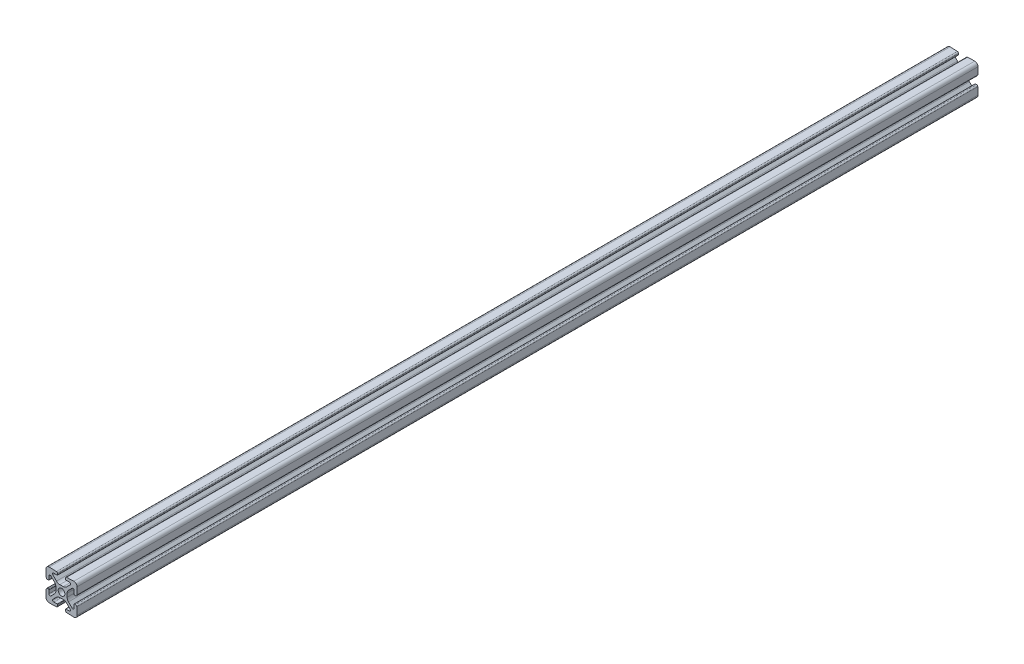
from build123d import *

# Parameters (mm, degrees)
BOSS_EXTRUDE1_DEPTH     = 304.8
CIRPATTERN1_COUNT       = 4
CUT_EXTRUDE1_DEPTH      = 306.611552742
CUT_EXTRUDE1_DEPTH_BACK = 306.611552742
SKETCH4_W               = 20.616616654
SKETCH4_H               = 34.076220988


with BuildPart() as part:
    # Sketch3 → Boss-Extrude1 (new, symmetric)
    with BuildSketch(Plane.XY):
        with BuildLine():
            Line((-2.524916986, 8.30911066), (-2.500487338, 9.008684239))
            ThreePointArc((-2.500487338, 9.008684239), (-2.714917039, 9.582202525), (-3.272080403, 9.836116498))
            Line((-3.272080403, 9.836116498), (-7.930201007, 9.998781654))
            ThreePointArc((-7.930201007, 9.998781654), (-9.414213562, 9.414213562), (-9.998781654, 7.930201007))
            Line((-9.998781654, 7.930201007), (-9.836116498, 3.272080403))
            ThreePointArc((-9.836116498, 3.272080403), (-9.582202525, 2.714917039), (-9.008684239, 2.500487338))
            Line((-9.008684239, 2.500487338), (-8.30911066, 2.524916986))
            ThreePointArc((-8.30911066, 2.524916986), (-8.100174399, 2.620134726), (-8.019763261, 2.835204083))
            Line((-8.019763261, 2.835204083), (-8.093719461, 4.953032548))
            ThreePointArc((-8.093719461, 4.953032548), (-7.631170264, 5.686128657), (-6.779559917, 5.52444538))
            Line((-6.779559917, 5.52444538), (-4.478679656, 3.22356512))
            ThreePointArc((-4.478679656, 3.22356512), (-3.828361402, 2.250295073), (-3.6, 1.102244776))
            Line((-3.6, 1.102244776), (-3.6, 0))
            Line((-3.6, 0), (-2.15, 0))
            ThreePointArc((-2.15, 0), (-1.52027958, 1.52027958), (0, 2.15))
            Line((0, 2.15), (0, 3.6))
            Line((0, 3.6), (-1.102244776, 3.6))
            ThreePointArc((-1.102244776, 3.6), (-2.250295073, 3.828361402), (-3.22356512, 4.478679656))
            Line((-3.22356512, 4.478679656), (-5.52444538, 6.779559917))
            ThreePointArc((-5.52444538, 6.779559917), (-5.686128657, 7.631170264), (-4.953032548, 8.093719461))
            Line((-4.953032548, 8.093719461), (-2.835204083, 8.019763261))
            ThreePointArc((-2.835204083, 8.019763261), (-2.620134726, 8.100174399), (-2.524916986, 8.30911066))
        make_face()
    boss_extrude1 = extrude(amount=BOSS_EXTRUDE1_DEPTH, both=True)

    # CirPattern1: Boss-Extrude1 ×4 about axis
    cirpattern1_axis = Axis((0, 0, 0), (0, 0, 1))
    for i in range(1, CIRPATTERN1_COUNT):
        add(boss_extrude1.rotate(cirpattern1_axis, i * 360 / CIRPATTERN1_COUNT))

    # Sketch4 → Cut-Extrude1 (cut, two sides: drawn at the far end of the back side and taken through both)
    with BuildSketch(Plane(origin=(0.339081089, 9.71001196, 0), x_dir=(0.9993908270190978, -0.034899496702443626, 0), z_dir=(0.034899496702443626, 0.9993908270190978, 0)).offset(-CUT_EXTRUDE1_DEPTH_BACK)):
        with Locations((-0.00156471, -292.238110494)):
            Rectangle(SKETCH4_W, SKETCH4_H)
    extrude(amount=CUT_EXTRUDE1_DEPTH + CUT_EXTRUDE1_DEPTH_BACK, mode=Mode.SUBTRACT)


solid = part.part
